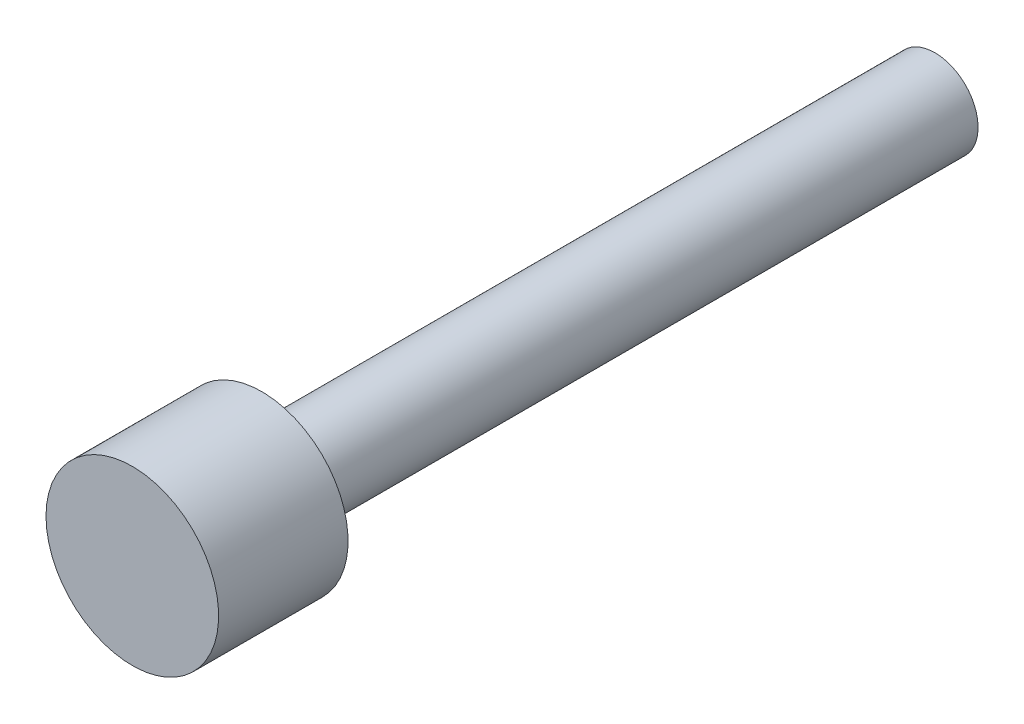
from build123d import *


with BuildPart() as part:
    # Sketch1 → Revolve1 (revolve)
    with BuildSketch(Plane(origin=(0, 0, 0), x_dir=(1, 0, 0), z_dir=(0, 1, 0))):
        Polygon((0, 0), (0, -465), (-50, -465), (-50, -390), (-25, -390), (-25, 0), align=None)
    revolve(axis=Axis((0, 0, 0), (0, 0, 1)))


solid = part.part
